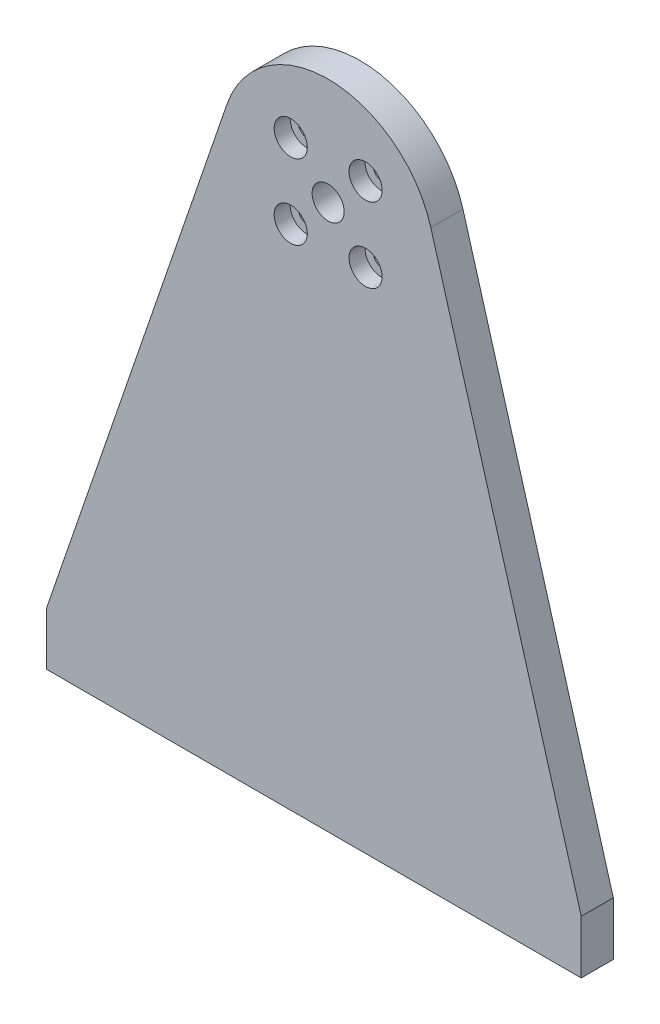
from build123d import *

# Parameters (mm, degrees)
SKETCH_1_R          = 3
EXTRUDE_1_DEPTH     = 6
SKETCH_2_R          = 3.1
CUT_EXTRUDE_6_DEPTH = 3
SKETCH_4_R          = 1.5
CUT_EXTRUDE_7_DEPTH = 129.481995307


with BuildPart() as part:
    # 草图1 → 凸台-拉伸1 (new body)
    with BuildSketch(Plane.XY):
        with BuildLine():
            Line((55.4927663, 10.009964479), (83.62403307, -87.496893342))
            Line((83.62403307, -87.496893342), (83.62403307, -97.496893342))
            Line((83.62403307, -97.496893342), (-16.37596693, -97.496893342))
            Line((-16.37596693, -97.496893342), (-16.37596693, -87.496893342))
            Line((-16.37596693, -87.496893342), (17.356392529, 10.94893296))
            ThreePointArc((17.356392529, 10.94893296), (36.768797098, 24.459911865), (55.4927663, 10.009964479))
        make_face()
        with Locations((36.276519563, 4.465971212)):
            Circle(SKETCH_1_R, mode=Mode.SUBTRACT)
    extrude(amount=EXTRUDE_1_DEPTH)

    # 草图2 → 切除-拉伸6 (cut)
    with BuildSketch(Plane.XY.offset(6)):
        with Locations((29.276519563, 11.465971212)):
            Circle(SKETCH_2_R)
        with Locations(Location((43.276519563, 11.465971212, 0), (0, 0, 180))):
            Circle(SKETCH_2_R)
        with Locations((43.276519563, -2.534028788)):
            Circle(SKETCH_2_R)
        with Locations(Location((29.276519563, -2.534028788, 0), (0, 0, 180))):
            Circle(SKETCH_2_R)
    extrude(amount=-CUT_EXTRUDE_6_DEPTH, mode=Mode.SUBTRACT)

    # 草图4 → 切除-拉伸7 (cut, through all)
    with BuildSketch(Plane.XY.offset(3)):
        with Locations((43.276519563, 11.465971212)):
            Circle(SKETCH_4_R)
        with Locations((43.276519563, -2.534028788)):
            Circle(SKETCH_4_R)
        with Locations((29.276519563, -2.534028788)):
            Circle(SKETCH_4_R)
        with Locations((29.276519563, 11.465971212)):
            Circle(SKETCH_4_R)
    extrude(amount=-CUT_EXTRUDE_7_DEPTH, mode=Mode.SUBTRACT)


solid = part.part
